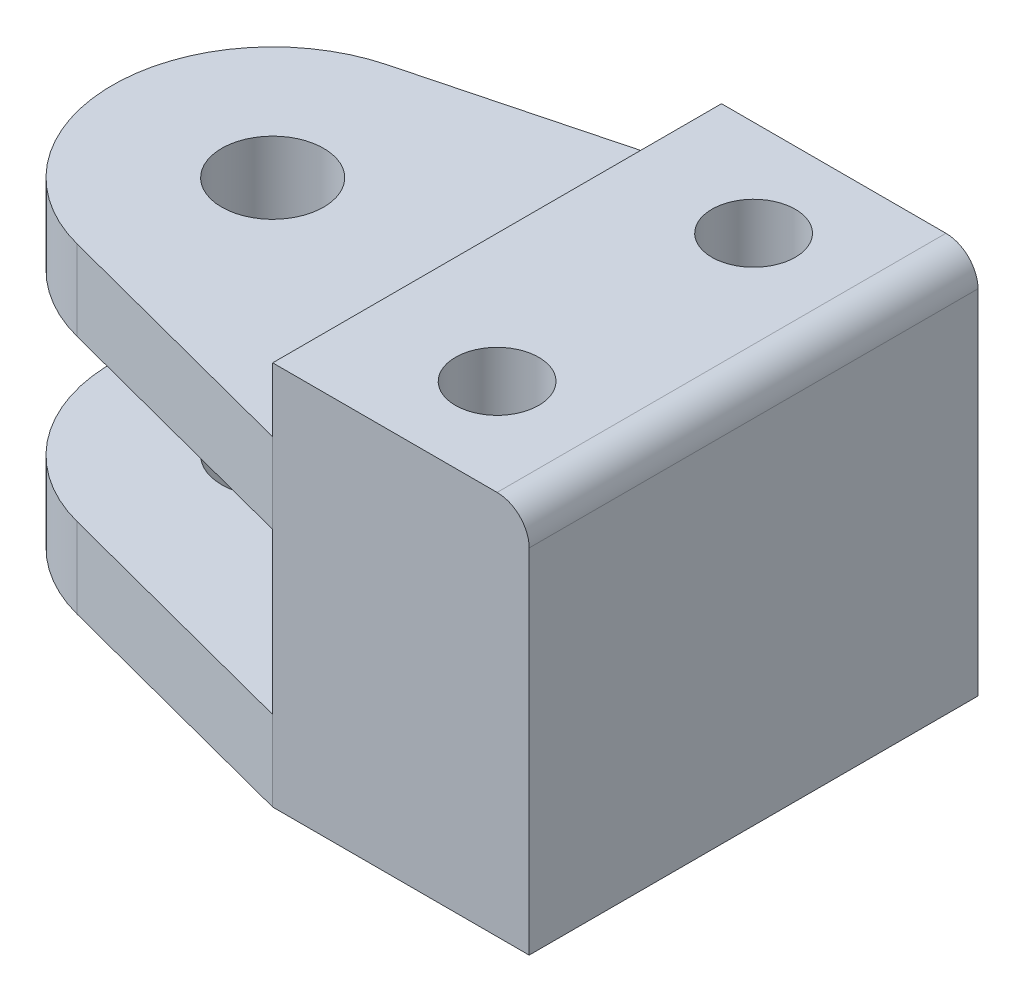
from build123d import *

# Parameters (mm, degrees)
BOSS_EXTRUDE1_DEPTH      = 7
BOSS_EXTRUDE1_DEPTH_BACK = 5
SKETCH1_W                = 8
SKETCH1_H                = 14
BOSS_EXTRUDE2_START      = 2.5
SKETCH1_3_R              = 1.59
BOSS_EXTRUDE2_DEPTH      = 2.5
BOSS_EXTRUDE3_START      = -5
SKETCH1_4_R              = 1.59
BOSS_EXTRUDE3_DEPTH      = 2.5
M2_CLEARANCE_HOLE1_D     = 2.6
CUT_EXTRUDE1_DEPTH       = 3
FILLET2_R                = 1


with BuildPart() as part:
    # Sketch1 → Boss-Extrude1 (new, two sides: drawn at the far end of the back side and taken through both)
    with BuildSketch(Plane(origin=(0, 0, 0), x_dir=(1, 0, 0), z_dir=(0, 1, 0)).offset(-BOSS_EXTRUDE1_DEPTH_BACK)):
        with Locations((11, 0)):
            Rectangle(SKETCH1_W, SKETCH1_H)
    extrude(amount=BOSS_EXTRUDE1_DEPTH + BOSS_EXTRUDE1_DEPTH_BACK)

    # Sketch1<3> → Boss-Extrude2 (add)
    with BuildSketch(Plane(origin=(0, 0, 0), x_dir=(1, 0, 0), z_dir=(0, 1, 0)).offset(BOSS_EXTRUDE2_START)):
        with BuildLine():
            Line((7, 7), (-1.265715623, 4.837144195))
            ThreePointArc((-1.265715623, 4.837144195), (-5, 0), (-1.265715623, -4.837144195))
            Line((-1.265715623, -4.837144195), (7, -7))
            Line((7, -7), (7, 7))
        make_face()
        with Locations(Location((0, 0, 0), (0, 0, 270))):
            Circle(SKETCH1_3_R, mode=Mode.SUBTRACT)
    extrude(amount=BOSS_EXTRUDE2_DEPTH)

    # Sketch1<4> → Boss-Extrude3 (add)
    with BuildSketch(Plane(origin=(0, 0, 0), x_dir=(1, 0, 0), z_dir=(0, 1, 0)).offset(BOSS_EXTRUDE3_START)):
        with BuildLine():
            Line((7, 7), (-1.265715623, 4.837144195))
            ThreePointArc((-1.265715623, 4.837144195), (-5, 0), (-1.265715623, -4.837144195))
            Line((-1.265715623, -4.837144195), (7, -7))
            Line((7, -7), (7, 7))
        make_face()
        with Locations(Location((0, 0, 0), (0, 0, 270))):
            Circle(SKETCH1_4_R, mode=Mode.SUBTRACT)
    extrude(amount=BOSS_EXTRUDE3_DEPTH)

    # M2 Clearance Hole1 (through all)
    with Locations(Plane(origin=(0, 7, 0), x_dir=(1, 0, 0), z_dir=(0, 1, 0))):
        with Locations((11, 4), (11, -4)):
            Hole(M2_CLEARANCE_HOLE1_D / 2)

    # Sketch4 → Cut-Extrude1 (cut)
    with BuildSketch(Plane.XZ.offset(5)):
        Polygon((9.816431948, 1.95), (12.183568052, 1.95), (13.367136104, 4), (12.183568052, 6.05), (9.816431948, 6.05), (8.632863896, 4), align=None)
        Polygon((8.632863896, -4), (9.816431948, -6.05), (12.183568052, -6.05), (13.367136104, -4), (12.183568052, -1.95), (9.816431948, -1.95), align=None)
    extrude(amount=-CUT_EXTRUDE1_DEPTH, mode=Mode.SUBTRACT)

    # Fillet2
    fillet2_edges = [part.edges().sort_by_distance(p)[0] for p in [
        (15, 7, 0),
    ]]
    fillet(fillet2_edges, radius=FILLET2_R)


solid = part.part
